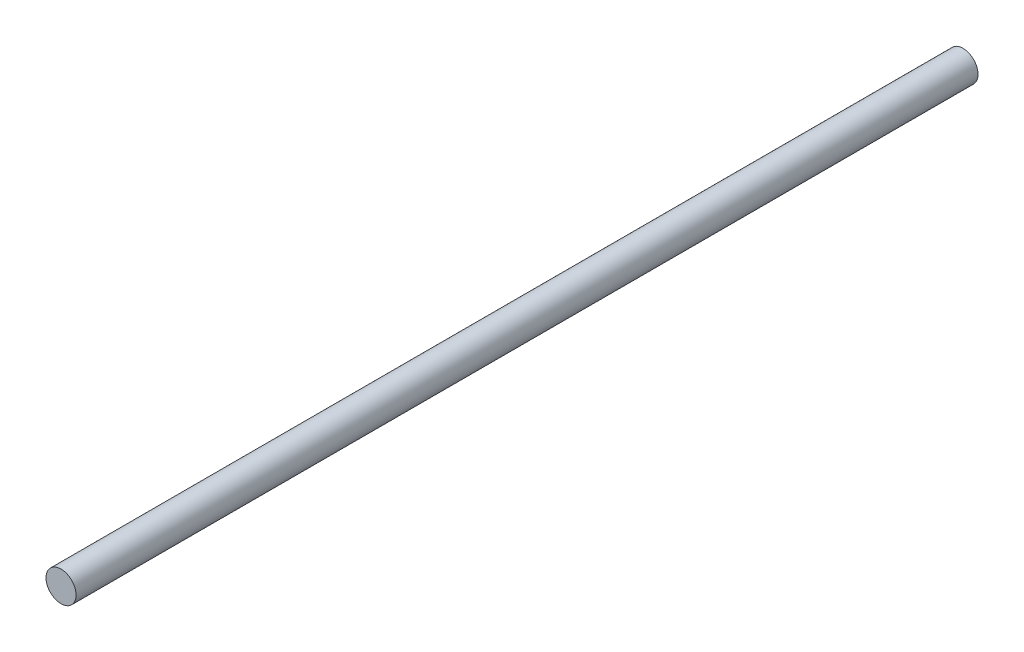
from build123d import *

# Parameters (mm, degrees)
ESQUISSE1_R        = 1.5
BOSS_EXTRU_1_DEPTH = 90


with BuildPart() as part:
    # Esquisse1 → Boss.-Extru.1 (new body)
    with BuildSketch(Plane.XY):
        with Locations(Location((0, 0, 0), (0, 0, 180))):
            Circle(ESQUISSE1_R)
    extrude(amount=BOSS_EXTRU_1_DEPTH)


solid = part.part
